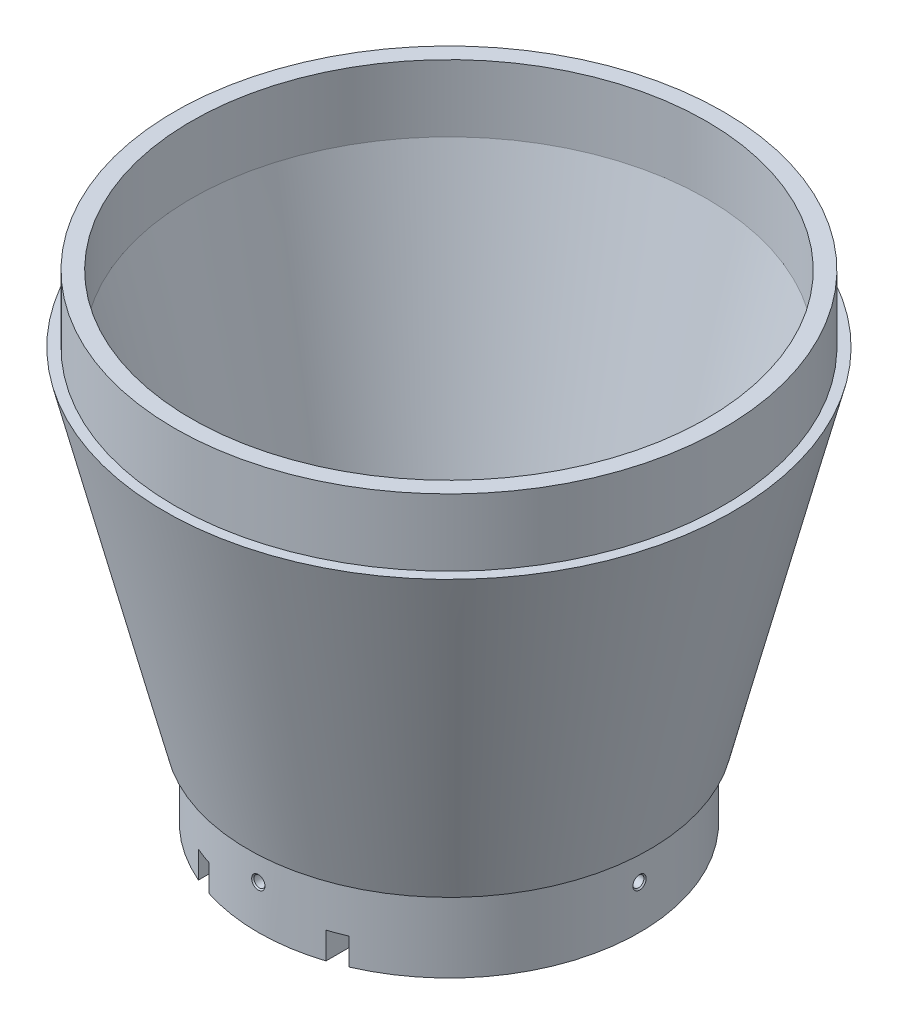
from build123d import *

# Parameters (mm, degrees)
BOSS_EXTRUDE1_REACH                   = 171.853
BOSS_EXTRUDE1_END_RADIUS              = 52
SKETCH3_W                             = 15
SKETCH3_H                             = 10
BOSS_EXTRUDE1_DIRECTION_2_REACH       = 171.853
BOSS_EXTRUDE1_DIRECTION_2_END_RADIUS  = 52
CUT_EXTRUDE1_DEPTH                    = 170.852877515
CUT_EXTRUDE1_DEPTH_BACK               = 170.852877515
SKETCH4_W                             = 5
SKETCH4_H                             = 8
M4_TAPPED_HOLE1_D                     = 3.3
M4_TAPPED_HOLE1_CSINK_D               = 4.05
M4_TAPPED_HOLE1_CSINK_ANGLE           = 90
M4_TAPPED_HOLE1_ON_FACE_2_D           = 3.3
M4_TAPPED_HOLE1_ON_FACE_2_CSINK_D     = 4.05
M4_TAPPED_HOLE1_ON_FACE_2_CSINK_ANGLE = 90
M4_TAPPED_HOLE1_ON_FACE_3_D           = 3.3
M4_TAPPED_HOLE1_ON_FACE_3_CSINK_D     = 4.05
M4_TAPPED_HOLE1_ON_FACE_3_CSINK_ANGLE = 90
M4_TAPPED_HOLE1_ON_FACE_4_D           = 3.3
M4_TAPPED_HOLE1_ON_FACE_4_CSINK_D     = 4.05
M4_TAPPED_HOLE1_ON_FACE_4_CSINK_ANGLE = 90


with BuildPart() as part:
    # Sketch1 → Revolve1 (revolve)
    with BuildSketch(Plane.XY, mode=Mode.PRIVATE) as revolve1_sk:
        Polygon((77, 120), (82, 120), (82, 100), (85, 100), (60, 0), (57, 0), (57, -23), (52, -23), (52, 0), (77, 100), align=None)
    revolve(revolve1_sk.sketch.rotate(Axis((0, 0, 0), (0, 1, 0)), 90), axis=Axis((0, 0, 0), (0, 1, 0)))

    # Boss-Extrude1: up to this cylinder (the profile starts inside it)
    boss_extrude1_end = Plane(origin=(0, -18, 0), z_dir=(0, -1, 0)) * Cylinder(BOSS_EXTRUDE1_END_RADIUS, 448.706, mode=Mode.PRIVATE)
    # Sketch3 → Boss-Extrude1 (add, up to the surface)
    with BuildSketch(Plane.XY, mode=Mode.PRIVATE) as boss_extrude1_sk1:
        with Locations((20, -18)):
            Rectangle(SKETCH3_W, SKETCH3_H)
    boss_extrude1_tool1 = extrude(boss_extrude1_sk1.sketch, amount=BOSS_EXTRUDE1_REACH, mode=Mode.PRIVATE) & boss_extrude1_end
    add(boss_extrude1_tool1.solids().sort_by_distance((20, -18, 0))[0])
    # Sketch3 → Boss-Extrude1 (add, up to the surface)
    with BuildSketch(Plane.XY, mode=Mode.PRIVATE) as boss_extrude1_sk2:
        with Locations((-20, -18)):
            Rectangle(SKETCH3_W, SKETCH3_H)
    boss_extrude1_tool2 = extrude(boss_extrude1_sk2.sketch, amount=BOSS_EXTRUDE1_REACH, mode=Mode.PRIVATE) & boss_extrude1_end
    add(boss_extrude1_tool2.solids().sort_by_distance((-20, -18, 0))[0])

    # Boss-Extrude1 direction 2: up to this cylinder (the profile starts inside it)
    boss_extrude1_direction_2_end = Plane(origin=(0, -18, 0), z_dir=(0, -1, 0)) * Cylinder(BOSS_EXTRUDE1_DIRECTION_2_END_RADIUS, 448.706, mode=Mode.PRIVATE)
    # Sketch3 → Boss-Extrude1 direction 2 (add, up to the surface)
    with BuildSketch(Plane.XY, mode=Mode.PRIVATE) as boss_extrude1_direction_2_sk1:
        with Locations((20, -18)):
            Rectangle(SKETCH3_W, SKETCH3_H)
    boss_extrude1_direction_2_tool1 = extrude(boss_extrude1_direction_2_sk1.sketch, amount=-BOSS_EXTRUDE1_DIRECTION_2_REACH, mode=Mode.PRIVATE) & boss_extrude1_direction_2_end
    add(boss_extrude1_direction_2_tool1.solids().sort_by_distance((20, -18, 0))[0])
    # Sketch3 → Boss-Extrude1 direction 2 (add, up to the surface)
    with BuildSketch(Plane.XY, mode=Mode.PRIVATE) as boss_extrude1_direction_2_sk2:
        with Locations((-20, -18)):
            Rectangle(SKETCH3_W, SKETCH3_H)
    boss_extrude1_direction_2_tool2 = extrude(boss_extrude1_direction_2_sk2.sketch, amount=-BOSS_EXTRUDE1_DIRECTION_2_REACH, mode=Mode.PRIVATE) & boss_extrude1_direction_2_end
    add(boss_extrude1_direction_2_tool2.solids().sort_by_distance((-20, -18, 0))[0])

    # Sketch4 → Cut-Extrude1 (cut, two sides: drawn at the far end of the back side and taken through both)
    with BuildSketch(Plane.XY.offset(-CUT_EXTRUDE1_DEPTH_BACK)):
        with Locations((-20, -19)):
            Rectangle(SKETCH4_W, SKETCH4_H)
        with Locations((20, -19)):
            Rectangle(SKETCH4_W, SKETCH4_H)
    extrude(amount=CUT_EXTRUDE1_DEPTH + CUT_EXTRUDE1_DEPTH_BACK, mode=Mode.SUBTRACT)

    # M4 Tapped Hole1 (through all)
    with Locations(Plane(origin=(0, -10, -57), x_dir=(0, -1, 0), z_dir=(0, 0, -1))):
        with Locations((0, 0)):
            CounterSinkHole(M4_TAPPED_HOLE1_D / 2, M4_TAPPED_HOLE1_CSINK_D / 2, counter_sink_angle=M4_TAPPED_HOLE1_CSINK_ANGLE)

    # M4 Tapped Hole1 on face 2 (through all)
    with Locations(Plane(origin=(-57, -10, 0), x_dir=(0, 0, -1), z_dir=(-1, 0, 0))):
        with Locations((0, 0)):
            CounterSinkHole(M4_TAPPED_HOLE1_ON_FACE_2_D / 2, M4_TAPPED_HOLE1_ON_FACE_2_CSINK_D / 2, counter_sink_angle=M4_TAPPED_HOLE1_ON_FACE_2_CSINK_ANGLE)

    # M4 Tapped Hole1 on face 3 (through all)
    with Locations(Plane(origin=(0, -10, 57), x_dir=(1, 0, 0), z_dir=(0, 0, 1))):
        with Locations((0, 0)):
            CounterSinkHole(M4_TAPPED_HOLE1_ON_FACE_3_D / 2, M4_TAPPED_HOLE1_ON_FACE_3_CSINK_D / 2, counter_sink_angle=M4_TAPPED_HOLE1_ON_FACE_3_CSINK_ANGLE)

    # M4 Tapped Hole1 on face 4 (through all)
    with Locations(Plane(origin=(57, -10, 0), x_dir=(0, 0, 1), z_dir=(1, 0, 0))):
        with Locations((0, 0)):
            CounterSinkHole(M4_TAPPED_HOLE1_ON_FACE_4_D / 2, M4_TAPPED_HOLE1_ON_FACE_4_CSINK_D / 2, counter_sink_angle=M4_TAPPED_HOLE1_ON_FACE_4_CSINK_ANGLE)


solid = part.part
